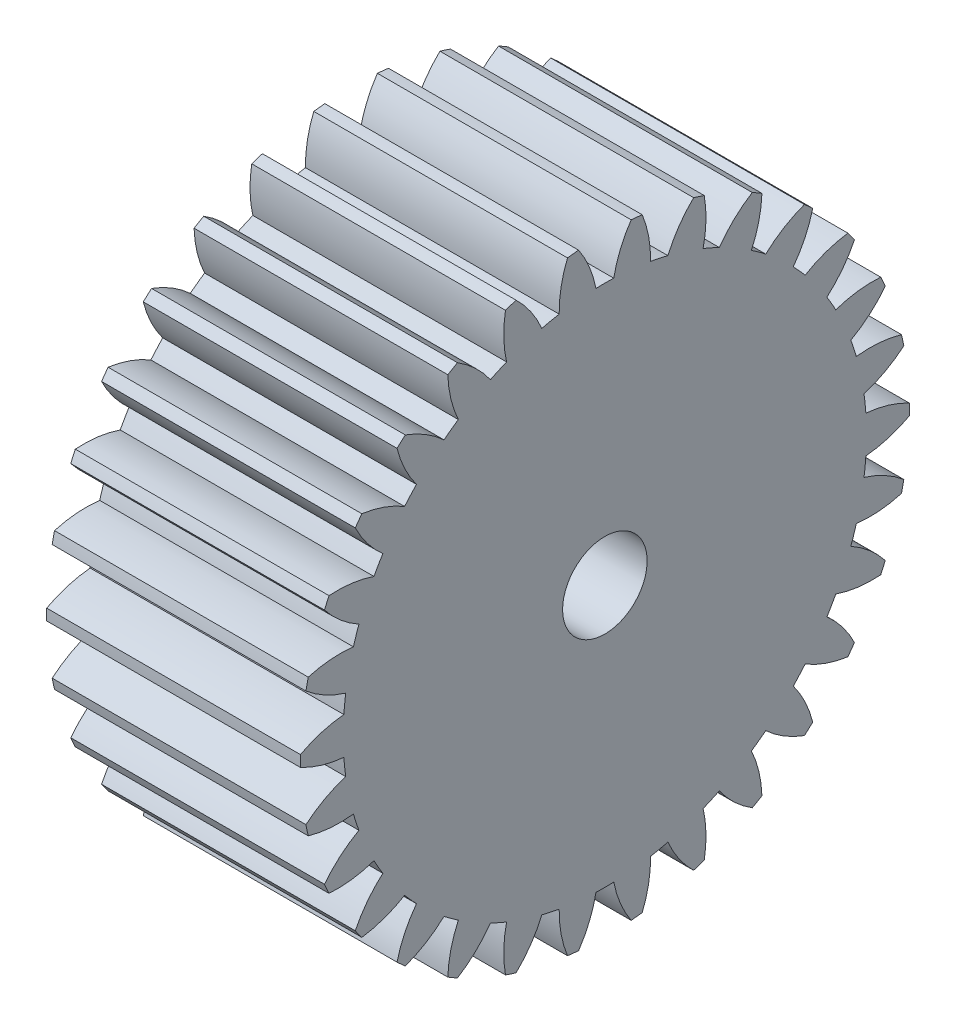
from build123d import *

# Parameters (mm, degrees)
BASPROSKE_W     = 12
BASPROSKE_H     = 14.4
TOOTHCUT_DEPTH  = 24.637258724
TEETHCUTS_COUNT = 30
TEETHCUTS_ANGLE = 348
BORSKE_R        = 2
BORE_DEPTH      = 50.0000508


with BuildPart() as part:
    # BasProSke → Base-Revolve (revolve)
    with BuildSketch(Plane(origin=(0, 0, 0), x_dir=(1, 0, 0), z_dir=(0, 1, 0)), mode=Mode.PRIVATE) as base_revolve_sk:
        with Locations((6, 7.2)):
            Rectangle(BASPROSKE_W, BASPROSKE_H)
    revolve(base_revolve_sk.sketch.rotate(Axis((-10, 0, 0), (1, 0, 0)), 180), axis=Axis((-10, 0, 0), (1, 0, 0)))

    # TooCutSke → ToothCut (cut, through all)
    with BuildSketch(Plane(origin=(0, 0, 0), x_dir=(0, 0, -1), z_dir=(1, 0, 0))):
        with BuildLine():
            ThreePointArc((0.419420089, 12.366889778), (0, 12.374), (-0.419420089, 12.366889778))
            ThreePointArc((-0.419420089, 12.366889778), (-0.73742304, 13.411275283), (-1.258990601, 14.370355174))
            ThreePointArc((-1.258990601, 14.370355174), (0, 14.4254), (1.258990601, 14.370355174))
            ThreePointArc((1.258990601, 14.370355174), (0.73742304, 13.411275283), (0.419420089, 12.366889778))
        make_face()
    toothcut = extrude(amount=TOOTHCUT_DEPTH, mode=Mode.SUBTRACT)

    # TeethCuts: ToothCut ×30 about axis
    teethcuts_axis = Axis((-10, 0, 0), (1, 0, 0))
    for i in range(1, TEETHCUTS_COUNT):
        add(toothcut.rotate(teethcuts_axis, i * TEETHCUTS_ANGLE / (TEETHCUTS_COUNT - 1)), mode=Mode.SUBTRACT)

    # BorSke → Bore (cut, symmetric)
    with BuildSketch(Plane(origin=(0, 0, 0), x_dir=(0, 0, -1), z_dir=(1, 0, 0))):
        with Locations(Location((0, 0, 0), (0, 0, 180))):
            Circle(BORSKE_R)
    extrude(amount=BORE_DEPTH, both=True, mode=Mode.SUBTRACT)


solid = part.part
